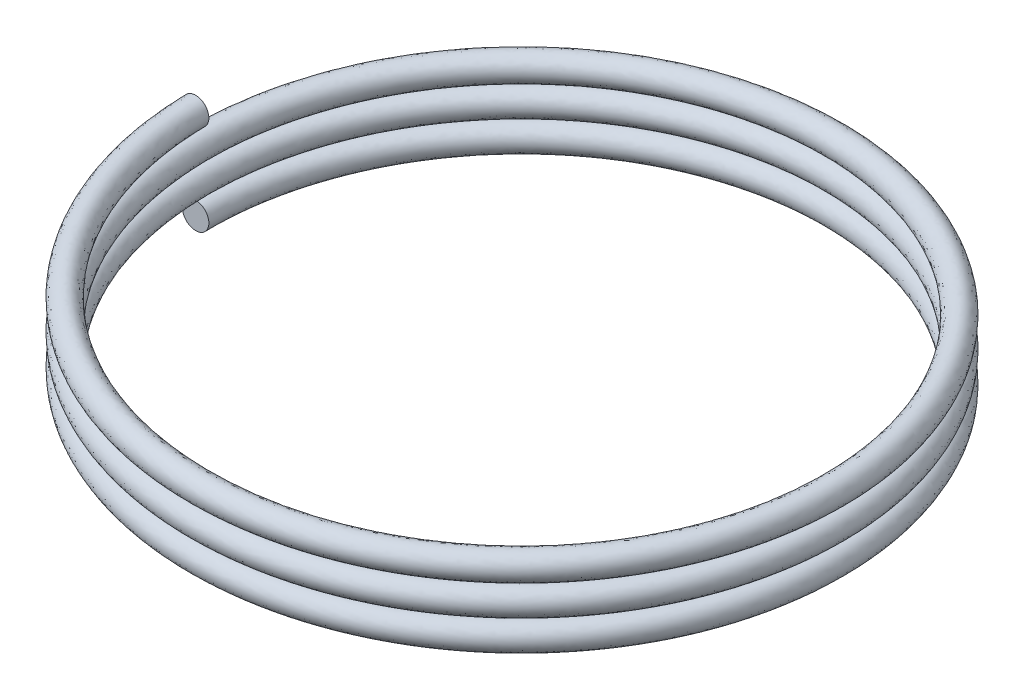
from build123d import *

# Parameters (mm, degrees)
SWEEP1_PITCH       = 2.921
SWEEP1_HEIGHT      = 8.763
SWEEP1_RADIUS      = 30.48
SWEEP1_START_ANGLE = -90
SKETCH3_R          = 1.27


with BuildPart() as part:
    # Sweep1: sweep along a helix
    with BuildLine() as sweep1_path:
        add(Helix(SWEEP1_PITCH, SWEEP1_HEIGHT, SWEEP1_RADIUS, center=(0, 0, 0), direction=(0, 1, 0), lefthand=True, mode=Mode.PRIVATE).rotate(Axis((0, 0, 0), (0, 1, 0)), SWEEP1_START_ANGLE))
    # Sketch3 → Sweep1 (sweep)
    with BuildSketch(Plane.XY):
        with Locations((-30.48, 0)):
            Circle(SKETCH3_R)
    sweep(path=sweep1_path.line, is_frenet=True)


solid = part.part
